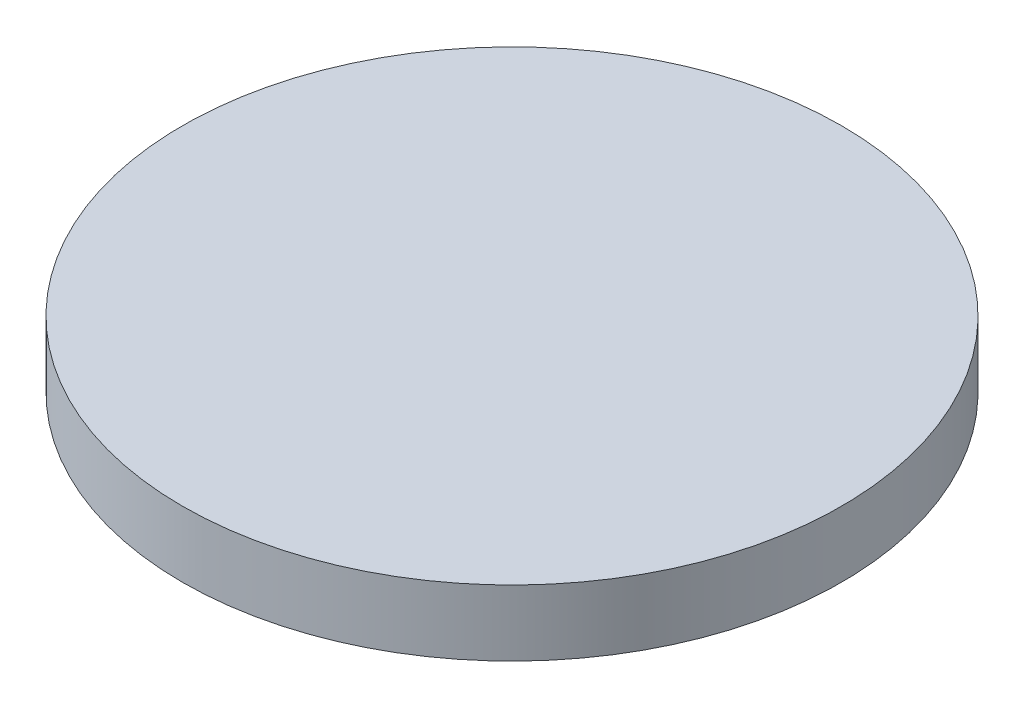
from build123d import *

# Parameters (mm, degrees)
SKETCH1_R           = 8
BOSS_EXTRUDE1_DEPTH = 1.6


with BuildPart() as part:
    # Sketch1 → Boss-Extrude1 (new body)
    with BuildSketch(Plane(origin=(0, 0, 0), x_dir=(1, 0, 0), z_dir=(0, 1, 0))):
        with Locations(Location((0, 0, 0), (0, 0, 270))):
            Circle(SKETCH1_R)
    extrude(amount=BOSS_EXTRUDE1_DEPTH)


solid = part.part
